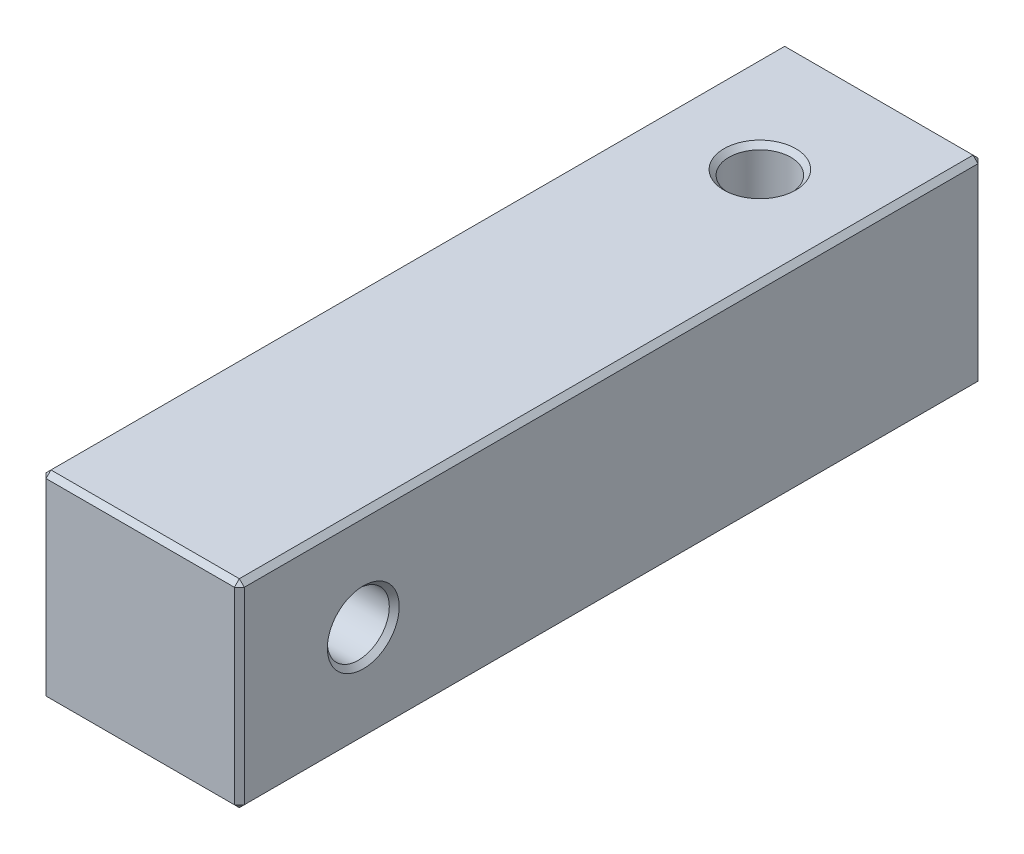
from build123d import *

# Parameters (mm, degrees)
SKETCH_1_W         = 8
SKETCH_1_H         = 8
EXTRUDE_1_DEPTH    = 15
HOLE_WIZARD_M3_1_D = 2.5
HOLE_WIZARD_M3_2_D = 2.5
CHAMFER_1_SIZE     = 0.2


with BuildPart() as part:
    # 草图1 → 凸台-拉伸1 (new, symmetric)
    with BuildSketch(Plane.XY):
        Rectangle(SKETCH_1_W, SKETCH_1_H)
    extrude(amount=EXTRUDE_1_DEPTH, both=True)

    # M3 螺纹孔1 (through all)
    with Locations(Plane(origin=(4, 0, 0), x_dir=(0, 0, -1), z_dir=(1, 0, 0))):
        with Locations((-10, 0)):
            Hole(HOLE_WIZARD_M3_1_D / 2)

    # M3 螺纹孔2 (through all)
    with Locations(Plane(origin=(0, 4, 0), x_dir=(1, 0, 0), z_dir=(0, 1, 0))):
        with Locations((0, 10)):
            Hole(HOLE_WIZARD_M3_2_D / 2)

    # 倒角1
    chamfer_1_edges = [part.edges().sort_by_distance(p)[0] for p in [
        (-4, 0, 15),
        (4, 0, 8.75),
        (-4, 0, 8.75),
        (0, -4, 15),
        (1.25, 4, -10),
        (1.25, -4, -10),
        (4, 0, 15),
        (0, -4, -15),
        (-4, 0, -15),
        (0, 4, -15),
        (4, 0, -15),
        (4, -4, 0),
        (-4, -4, 0),
        (-4, 4, 0),
        (4, 4, 0),
        (0, 4, 15),
    ]]
    chamfer(chamfer_1_edges, length=CHAMFER_1_SIZE)


solid = part.part
